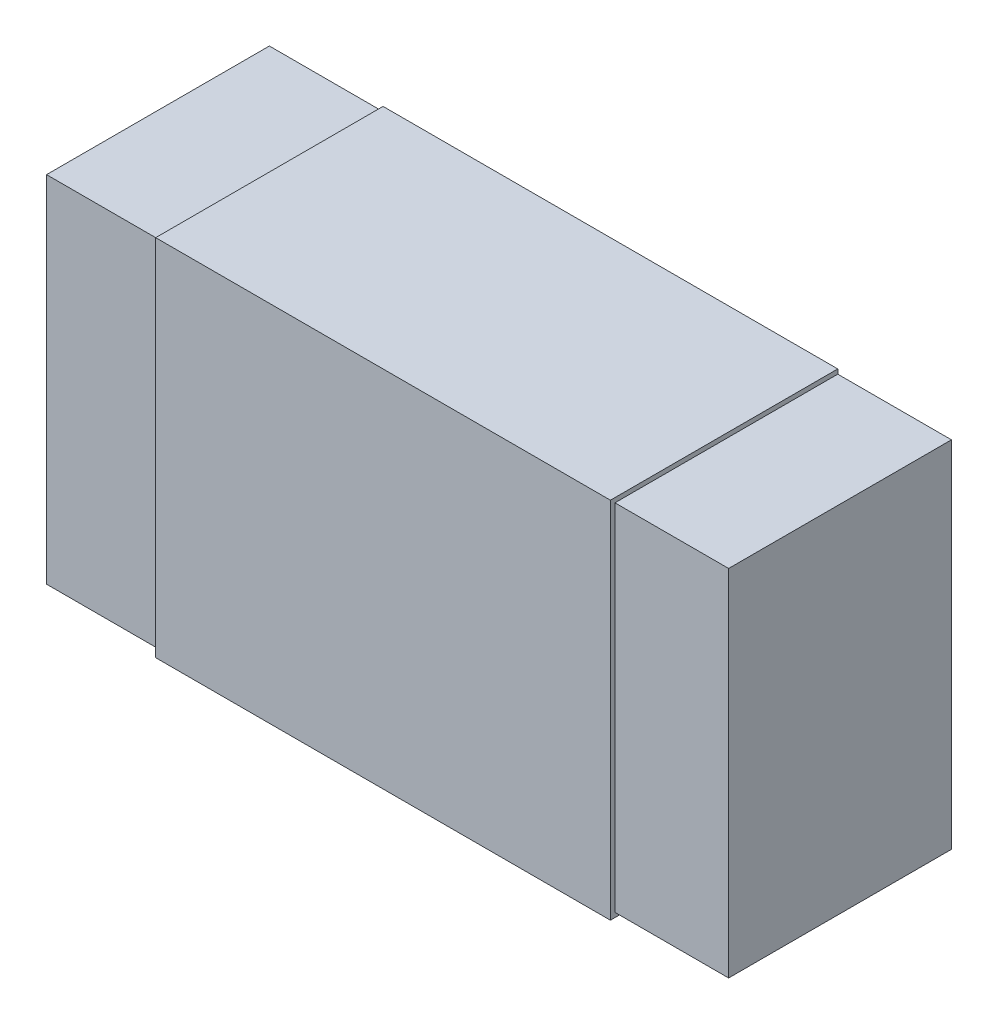
from build123d import *

# Parameters (mm, degrees)
SKETCH1_W           = 1
SKETCH1_H           = 0.8
BOSS_EXTRUDE1_DEPTH = 0.5
SKETCH4_W           = 0.25
SKETCH4_H           = 0.78
BOSS_EXTRUDE3_DEPTH = 0.49


with BuildPart() as part:
    # Sketch1 → Boss-Extrude1 (new body)
    with BuildSketch(Plane.XY):
        Rectangle(SKETCH1_W, SKETCH1_H)
    extrude(amount=BOSS_EXTRUDE1_DEPTH)

    # Sketch4 → Boss-Extrude3 (add)
    with BuildSketch(Plane(origin=(0, 0, 0), x_dir=(-1, 0, 0), z_dir=(0, 0, -1))):
        with Locations((-0.625, 0)):
            Rectangle(SKETCH4_W, SKETCH4_H)
        with Locations((0.625, 0)):
            Rectangle(SKETCH4_W, SKETCH4_H)
    extrude(amount=-BOSS_EXTRUDE3_DEPTH)


solid = part.part
